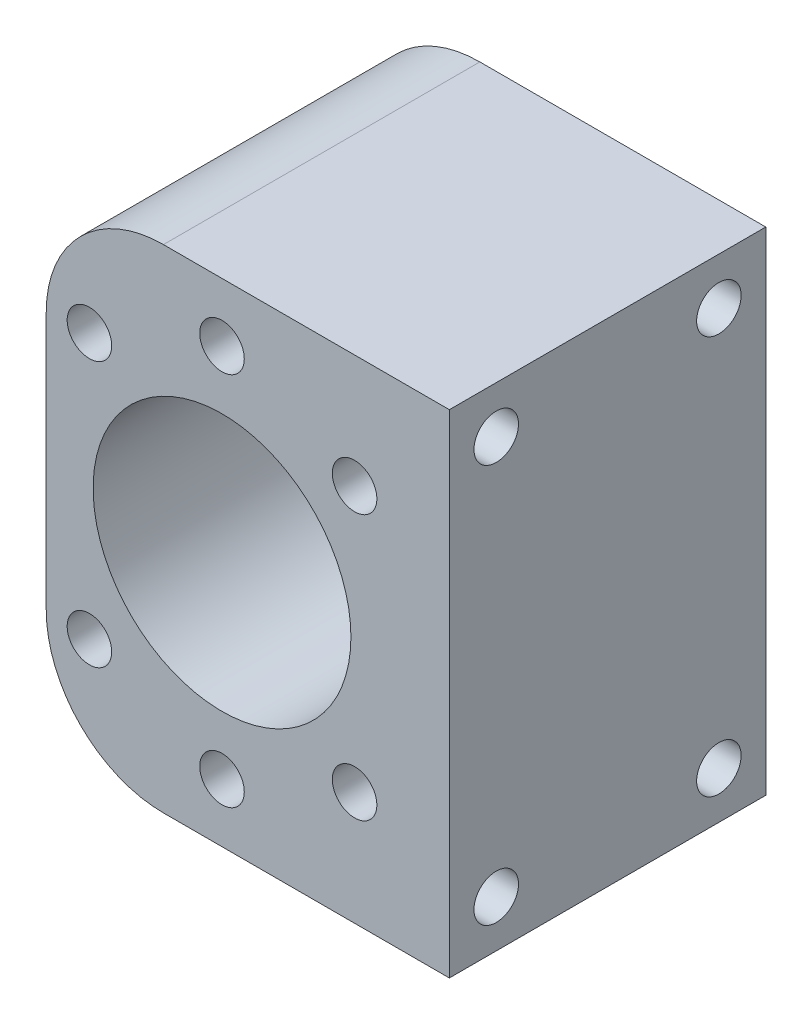
from build123d import *

# Parameters (mm, degrees)
SKETCH1_W           = 30
SKETCH1_H           = 42
BOSS_EXTRUDE1_DEPTH = 13.5
SKETCH2_R           = 11
CUT_EXTRUDE1_DEPTH  = 38.349698794
SKETCH3_R           = 1.9
CUT_EXTRUDE2_DEPTH  = 10
SKETCH7_W           = 27
SKETCH7_H           = 42
BOSS_EXTRUDE2_DEPTH = 4.4
SKETCH6_R           = 1.9
CUT_EXTRUDE3_DEPTH  = 10
FILLET1_R           = 10


with BuildPart() as part:
    # Sketch1 → Boss-Extrude1 (new, symmetric)
    with BuildSketch(Plane.XY):
        Rectangle(SKETCH1_W, SKETCH1_H)
    extrude(amount=BOSS_EXTRUDE1_DEPTH, both=True)

    # Sketch2 → Cut-Extrude1 (cut, through all)
    with BuildSketch(Plane.XY.offset(13.5)):
        Circle(SKETCH2_R)
    extrude(amount=-CUT_EXTRUDE1_DEPTH, mode=Mode.SUBTRACT)

    # Sketch3 → Cut-Extrude2 (cut)
    with BuildSketch(Plane.XY.offset(13.5)):
        with Locations((-11.313708499, 11.313708499)):
            Circle(SKETCH3_R)
        with Locations((0, 16)):
            Circle(SKETCH3_R)
        with Locations((11.313708499, 11.313708499)):
            Circle(SKETCH3_R)
        with Locations((11.313708499, -11.313708499)):
            Circle(SKETCH3_R)
        with Locations((0, -16)):
            Circle(SKETCH3_R)
        with Locations((-11.313708499, -11.313708499)):
            Circle(SKETCH3_R)
    extrude(amount=-CUT_EXTRUDE2_DEPTH, mode=Mode.SUBTRACT)

    # Sketch7 → Boss-Extrude2 (add)
    with BuildSketch(Plane(origin=(15, 0, 0), x_dir=(0, 0, -1), z_dir=(1, 0, 0))):
        Rectangle(SKETCH7_W, SKETCH7_H)
    extrude(amount=BOSS_EXTRUDE2_DEPTH)

    # Sketch6 → Cut-Extrude3 (cut)
    with BuildSketch(Plane(origin=(19.4, 0, 0), x_dir=(0, 0, -1), z_dir=(1, 0, 0))):
        with Locations((9.5, 17)):
            Circle(SKETCH6_R)
        with Locations((-9.5, 17)):
            Circle(SKETCH6_R)
        with Locations((9.5, -17)):
            Circle(SKETCH6_R)
        with Locations((-9.5, -17)):
            Circle(SKETCH6_R)
    extrude(amount=-CUT_EXTRUDE3_DEPTH, mode=Mode.SUBTRACT)

    # Fillet1
    fillet1_edges = [part.edges().sort_by_distance(p)[0] for p in [
        (-15, -21, 0),
        (-15, 21, 0),
    ]]
    fillet(fillet1_edges, radius=FILLET1_R)


solid = part.part
